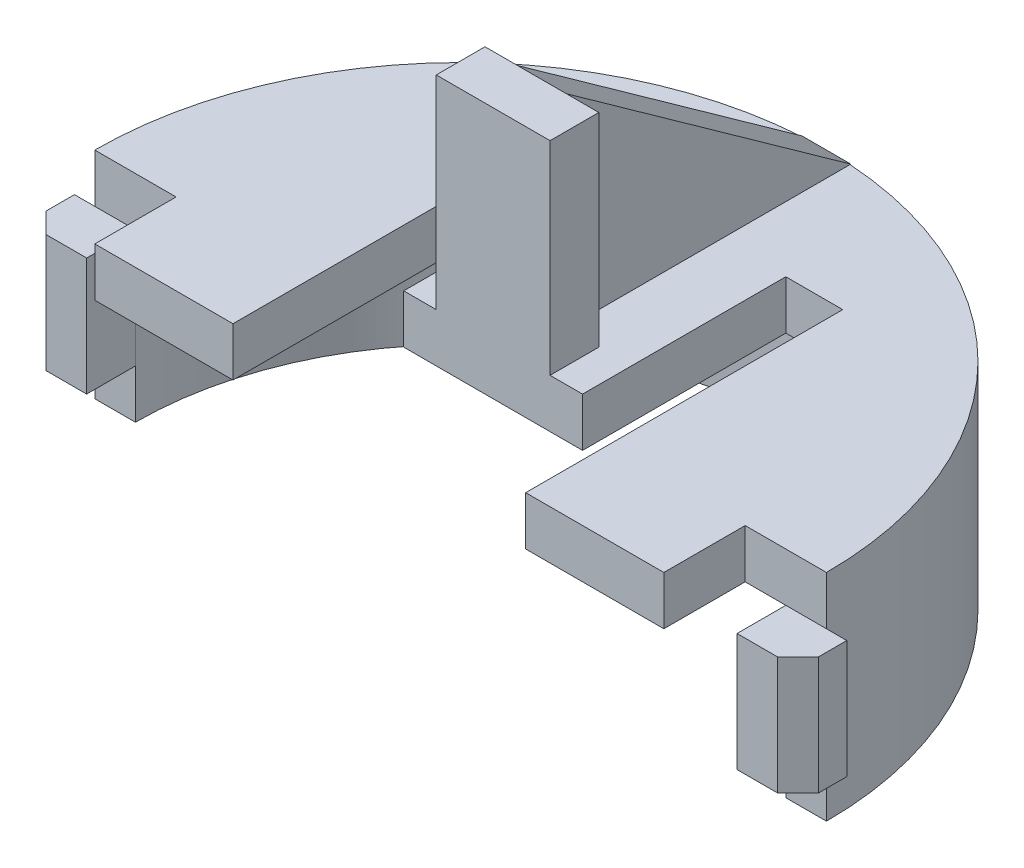
from build123d import *

# Parameters (mm, degrees)
SKETCH1_W                = 8
SKETCH1_H                = 1.2
SKETCH1_W_2              = 1
SKETCH1_H_2              = 4.1
REVOLVE1_ANGLE           = 180
SKETCH2_W                = 6.21
SKETCH2_H                = 1.5
CUT_EXTRUDE1_DEPTH       = 14.787313009
CUT_EXTRUDE2_DEPTH       = 14.787313009
SKETCH4_W                = 3.4
SKETCH4_H                = 2
BOSS_EXTRUDE1_DEPTH      = 1.2
SKETCH5_W                = 1.2
SKETCH5_H                = 2.9
BOSS_EXTRUDE2_DEPTH      = 1.5
CHAMFER1_SIZE            = 0.5
CHAMFER1_OF_MIRROR2_SIZE = 0.5
SKETCH6_W                = 2.8
SKETCH6_H                = 5
BOSS_EXTRUDE3_DEPTH      = 1.2
BOSS_EXTRUDE4_DEPTH      = 0.6


with BuildPart() as part:
    # Sketch1 → Revolve1 (revolve)
    with BuildSketch(Plane.XY):
        with Locations((4, 4.7)):
            Rectangle(SKETCH1_W, SKETCH1_H)
        with Locations((8.5, 4.7)):
            Rectangle(SKETCH1_W_2, SKETCH1_H)
        with Locations((8.5, 2.05)):
            Rectangle(SKETCH1_W_2, SKETCH1_H_2)
    revolve(axis=Axis((0, 0, 0), (0, 1, 0)), revolution_arc=REVOLVE1_ANGLE)

    # Sketch2 → Cut-Extrude1 (cut, through all)
    with BuildSketch(Plane.XY):
        with Locations((0, 3.35)):
            Rectangle(SKETCH2_W, SKETCH2_H)
    extrude(amount=-CUT_EXTRUDE1_DEPTH, mode=Mode.SUBTRACT)

    # Sketch3 → Cut-Extrude2 (cut, through all)
    with BuildSketch(Plane(origin=(0, 5.3, 0), x_dir=(1, 0, 0), z_dir=(0, 1, 0))):
        Polygon((-2.2, 5.8), (-3.6, 5.8), (-3.6, 0), (3.6, 0), (3.6, 5.8), (2.2, 5.8), (2.2, 0.8), (-2.2, 0.8), align=None)
    extrude(amount=-CUT_EXTRUDE2_DEPTH, mode=Mode.SUBTRACT)

    # Sketch4 → Boss-Extrude1 (add)
    with BuildSketch(Plane(origin=(0, 5.3, 0), x_dir=(1, 0, 0), z_dir=(0, 1, 0))):
        with Locations((5.3, -1)):
            Rectangle(SKETCH4_W, SKETCH4_H)
        with Locations((-5.3, -1)):
            Rectangle(SKETCH4_W, SKETCH4_H)
    extrude(amount=-BOSS_EXTRUDE1_DEPTH)

    # Sketch5 → Boss-Extrude2 (add)
    with BuildSketch(Plane(origin=(8, 0, 0), x_dir=(0, 0, -1), z_dir=(1, 0, 0))):
        with Locations((-0.6, 2.65)):
            Rectangle(SKETCH5_W, SKETCH5_H)
    boss_extrude2 = extrude(amount=BOSS_EXTRUDE2_DEPTH)

    # Chamfer1
    chamfer1_edges = [part.edges().sort_by_distance(p)[0] for p in [
        (9.5, 2.65, 1.2),
    ]]
    chamfer(chamfer1_edges, length=CHAMFER1_SIZE)

    # Mirror2: Boss-Extrude2 across plane
    add(boss_extrude2.mirror(Plane(origin=(0, 0, 0), x_dir=(0, 0, 1), z_dir=(1, 0, 0))))

    # Chamfer1 of Mirror2
    chamfer1_of_mirror2_edges = [part.edges().sort_by_distance(p)[0] for p in [
        (-9.5, 2.65, 1.2),
    ]]
    chamfer(chamfer1_of_mirror2_edges, length=CHAMFER1_OF_MIRROR2_SIZE)

    # Sketch6 → Boss-Extrude3 (add)
    with BuildSketch(Plane.XY.offset(-0.8)):
        with Locations((0, 7.8)):
            Rectangle(SKETCH6_W, SKETCH6_H)
    extrude(amount=-BOSS_EXTRUDE3_DEPTH)

    # Sketch7 → Boss-Extrude4 (add, symmetric)
    with BuildSketch(Plane(origin=(0, 0, 0), x_dir=(0, 0, -1), z_dir=(1, 0, 0))):
        Polygon((2, 10.3), (9, 5.3), (2, 5.3), align=None)
    extrude(amount=BOSS_EXTRUDE4_DEPTH, both=True)


solid = part.part
